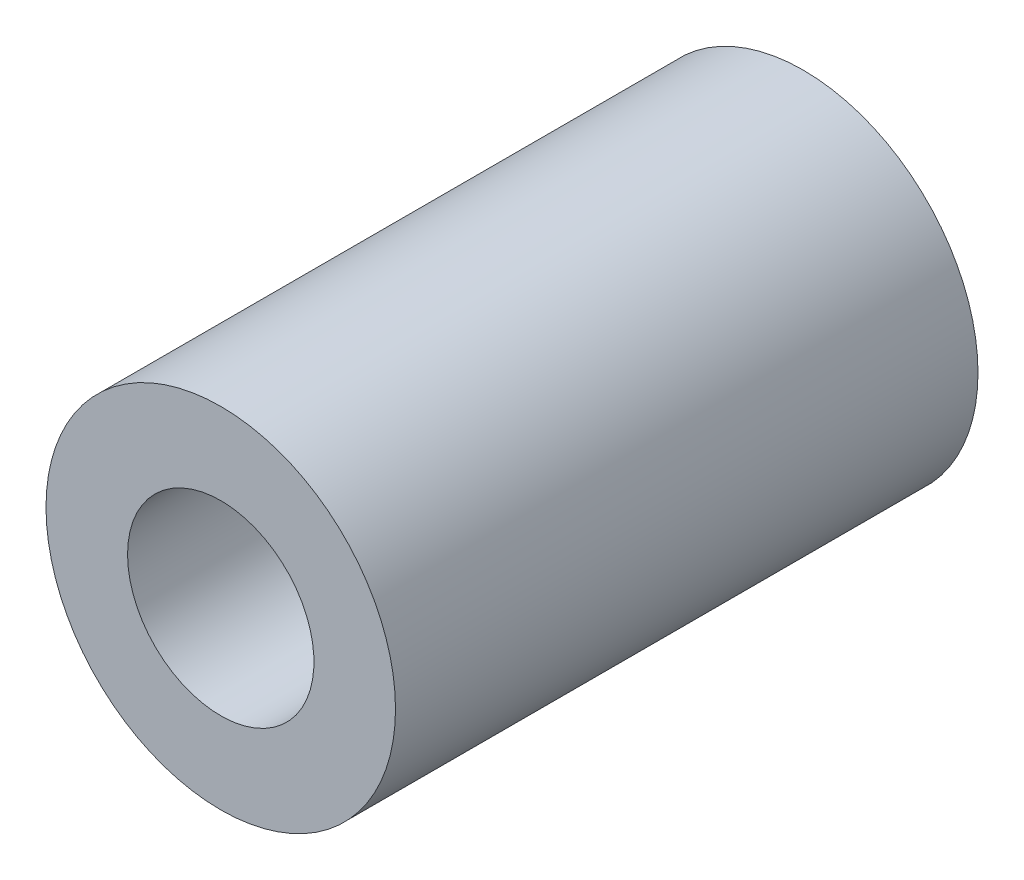
from build123d import *

# Parameters (mm, degrees)
SKETCH_1_R         = 1.5
EXTRUDE_1_DEPTH    = 5
HOLE_WIZARD_M2_1_D = 1.6


with BuildPart() as part:
    # 草图1 → 凸台-拉伸1 (new body)
    with BuildSketch(Plane.XY):
        Circle(SKETCH_1_R)
    extrude(amount=EXTRUDE_1_DEPTH)

    # M2 螺纹孔1 (through all)
    with Locations(Plane(origin=(0, 0, 0), x_dir=(-1, 0, 0), z_dir=(0, 0, -1))):
        with Locations((0, 0)):
            Hole(HOLE_WIZARD_M2_1_D / 2)


solid = part.part
